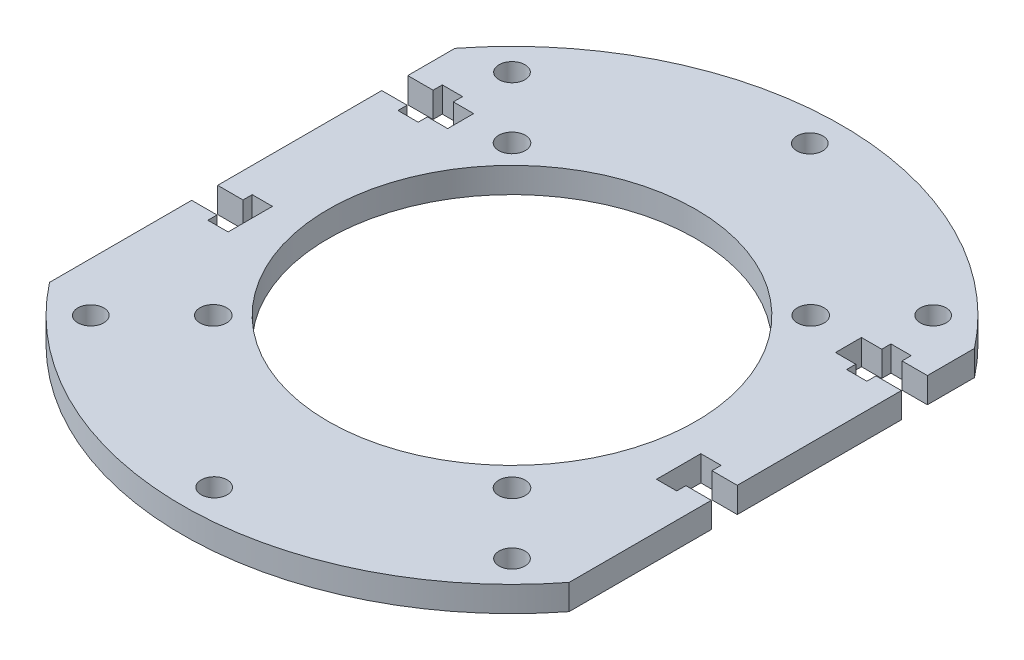
from build123d import *

# Parameters (mm, degrees)
SKETCH_1_R          = 52
SKETCH_1_R_2        = 29
SKETCH_1_R_3        = 2.05
SKETCH_1_R_4        = 2.1
EXTRUDE_1_DEPTH     = 4
SKETCH_2_W          = 182
SKETCH_2_H          = 210.035227354
SKETCH_2_W_2        = 82
SKETCH_2_H_2        = 110.035227354
CUT_EXTRUDE_1_DEPTH = 4


with BuildPart() as part:
    # 草图1 → 凸台-拉伸1 (new body)
    with BuildSketch(Plane(origin=(0, 0, 0), x_dir=(1, 0, 0), z_dir=(0, 1, 0))):
        with Locations(Location((0, 0, 0), (0, 0, 270))):
            Circle(SKETCH_1_R)
        with Locations(Location((0, 0, 0), (0, 0, 270))):
            Circle(SKETCH_1_R_2, mode=Mode.SUBTRACT)
        with Locations(Location((47, 0, 0), (0, 0, 270))):
            Circle(SKETCH_1_R_3, mode=Mode.SUBTRACT)
        with Locations(Location((33.234018716, -33.234018716, 0), (0, 0, 270))):
            Circle(SKETCH_1_R_3, mode=Mode.SUBTRACT)
        with Locations(Location((0, -47, 0), (0, 0, 270))):
            Circle(SKETCH_1_R_3, mode=Mode.SUBTRACT)
        with Locations(Location((-33.234018716, -33.234018716, 0), (0, 0, 270))):
            Circle(SKETCH_1_R_3, mode=Mode.SUBTRACT)
        with Locations(Location((-47, 0, 0), (0, 0, 270))):
            Circle(SKETCH_1_R_3, mode=Mode.SUBTRACT)
        with Locations(Location((-33.234018716, 33.234018716, 0), (0, 0, 270))):
            Circle(SKETCH_1_R_3, mode=Mode.SUBTRACT)
        with Locations(Location((0, 47, 0), (0, 0, 270))):
            Circle(SKETCH_1_R_3, mode=Mode.SUBTRACT)
        with Locations(Location((33.234018716, 33.234018716, 0), (0, 0, 270))):
            Circle(SKETCH_1_R_3, mode=Mode.SUBTRACT)
        with Locations(Location((-23.57, 23.57, 0), (0, 0, 270))):
            Circle(SKETCH_1_R_4, mode=Mode.SUBTRACT)
        with Locations(Location((-23.57, -23.57, 0), (0, 0, 270))):
            Circle(SKETCH_1_R_4, mode=Mode.SUBTRACT)
        with Locations(Location((23.57, -23.57, 0), (0, 0, 90))):
            Circle(SKETCH_1_R_4, mode=Mode.SUBTRACT)
        with Locations(Location((23.57, 23.57, 0), (0, 0, 90))):
            Circle(SKETCH_1_R_4, mode=Mode.SUBTRACT)
        Polygon((37, -9.55), (37, -11), (33.8, -11), (33.8, -9.55), (33.8, -5.45), (33.8, -4), (37, -4), (37, -5.45), (41, -5.45), (41, -9.55), align=None, mode=Mode.SUBTRACT)
        Polygon((37, 20.45), (37, 19), (33.8, 19), (33.8, 20.45), (30.6, 20.45), (30.6, 24.55), (33.8, 24.55), (33.8, 26), (37, 26), (37, 24.55), (41, 24.55), (41, 20.45), align=None, mode=Mode.SUBTRACT)
        Polygon((-33.8, 26), (-37, 26), (-37, 24.55), (-41, 24.55), (-41, 20.45), (-37, 20.45), (-37, 19), (-33.8, 19), (-33.8, 20.45), (-30.6, 20.45), (-30.6, 24.55), (-33.8, 24.55), align=None, mode=Mode.SUBTRACT)
        Polygon((-33.8, -4), (-37, -4), (-37, -5.45), (-41, -5.45), (-41, -9.55), (-37, -9.55), (-37, -11), (-33.8, -11), (-33.8, -9.55), (-33.8, -5.45), align=None, mode=Mode.SUBTRACT)
    extrude(amount=EXTRUDE_1_DEPTH)

    # 草图2 → 切除-拉伸-薄壁1 (cut)
    with BuildSketch(Plane(origin=(0, 4, 0), x_dir=(1, 0, 0), z_dir=(0, 1, 0))):
        Rectangle(SKETCH_2_W, SKETCH_2_H)
        Rectangle(SKETCH_2_W_2, SKETCH_2_H_2, mode=Mode.SUBTRACT)
    extrude(amount=-CUT_EXTRUDE_1_DEPTH, mode=Mode.SUBTRACT)


solid = part.part
